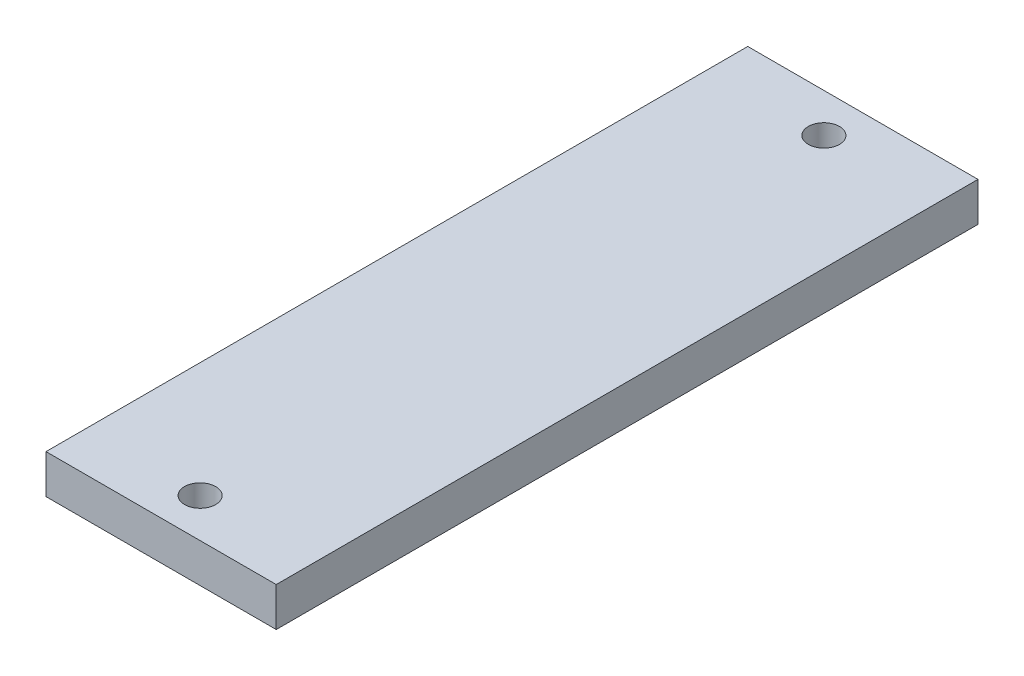
from build123d import *

# Parameters (mm, degrees)
SKETCH1_W           = 37.5
SKETCH1_H           = 114.3
BOSS_EXTRUDE1_DEPTH = 6.35
SKETCH3_R           = 2.54
CUT_EXTRUDE2_DEPTH  = 9.525


with BuildPart() as part:
    # Sketch1 → Boss-Extrude1 (new body)
    with BuildSketch(Plane(origin=(0, 0, 0), x_dir=(1, 0, 0), z_dir=(0, 1, 0))):
        Rectangle(SKETCH1_W, SKETCH1_H)
    extrude(amount=BOSS_EXTRUDE1_DEPTH)

    # Sketch3 → Cut-Extrude2 (cut)
    with BuildSketch(Plane(origin=(0, 6.35, 0), x_dir=(1, 0, 0), z_dir=(0, 1, 0))):
        with Locations(Location((0, 50.8, 0), (0, 0, 270))):
            Circle(SKETCH3_R)
        with Locations(Location((0, -50.8, 0), (0, 0, 270))):
            Circle(SKETCH3_R)
    extrude(amount=-CUT_EXTRUDE2_DEPTH, mode=Mode.SUBTRACT)


solid = part.part
